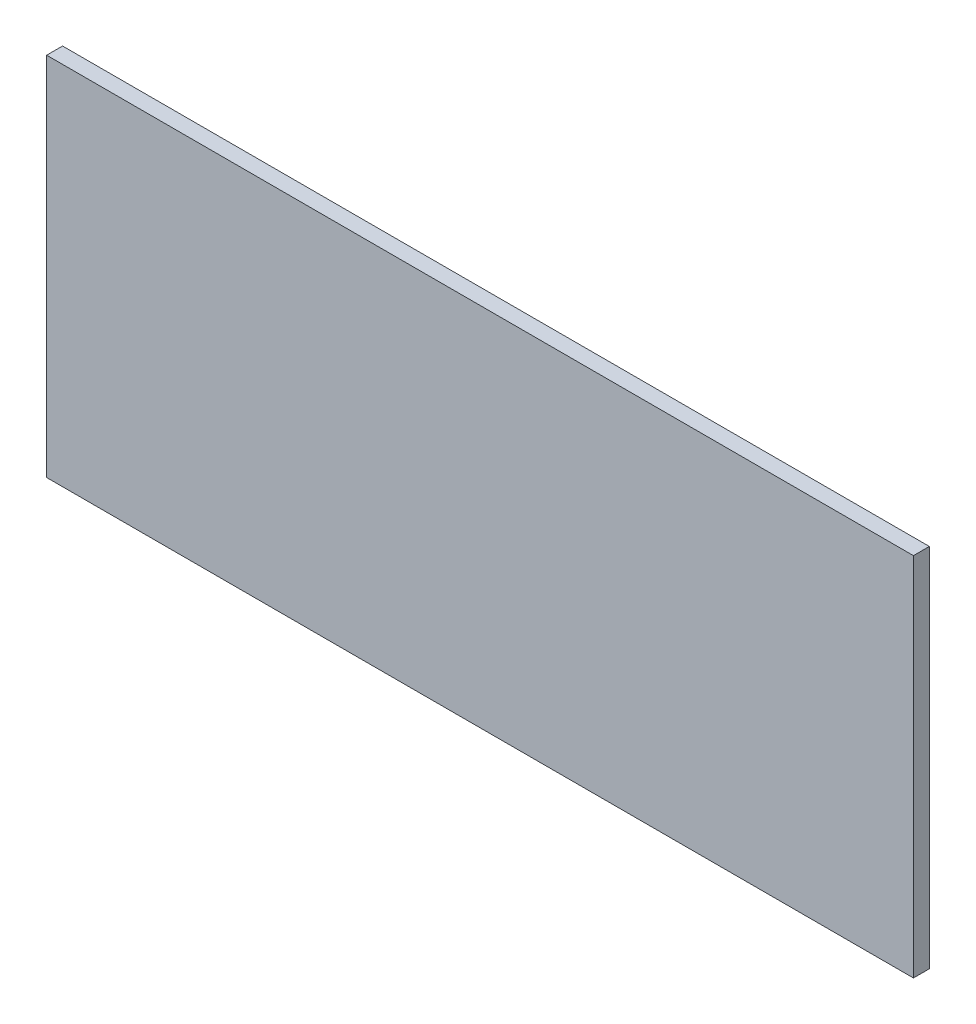
from build123d import *

# Parameters (mm, degrees)
SKETCH_1_W      = 545
SKETCH_1_H      = 230
EXTRUDE_1_DEPTH = 10


with BuildPart() as part:
    # 草图1 → 凸台-拉伸1 (new body)
    with BuildSketch(Plane.XY):
        Rectangle(SKETCH_1_W, SKETCH_1_H)
    extrude(amount=EXTRUDE_1_DEPTH)


solid = part.part
